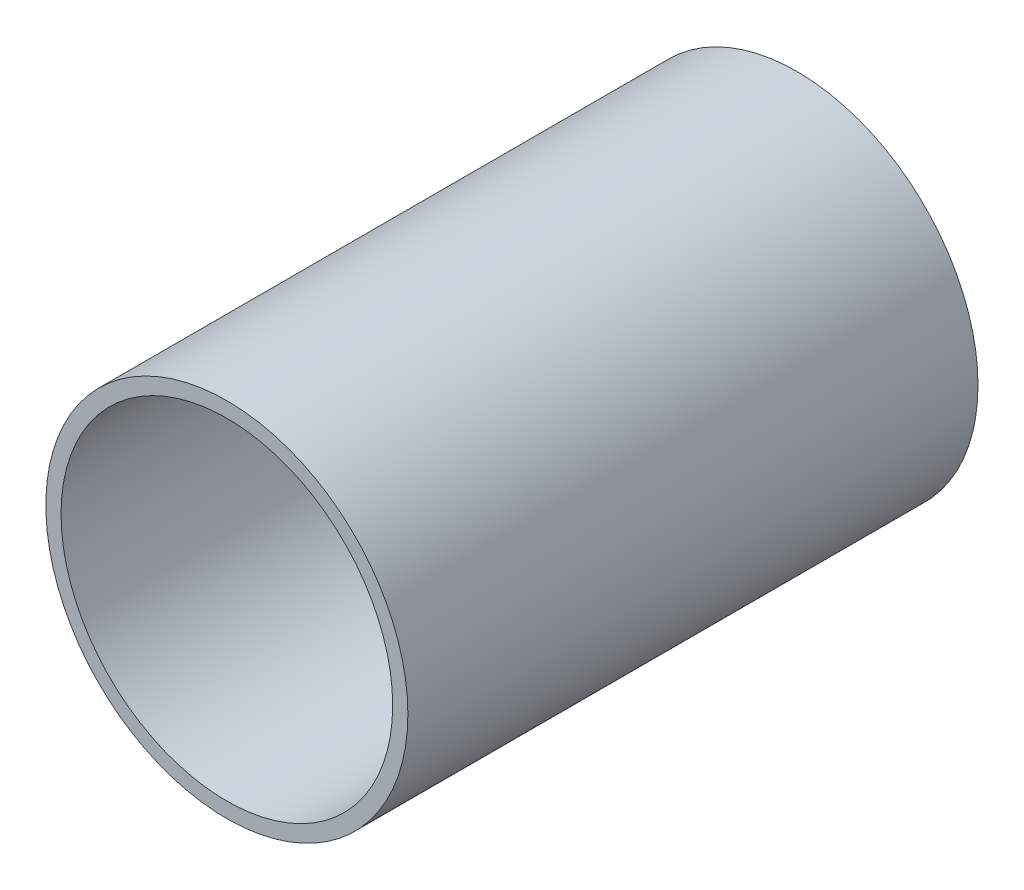
from build123d import *

# Parameters (mm, degrees)
SKETCH_1_R      = 19.05
SKETCH_1_R_2    = 17.45
EXTRUDE_1_DEPTH = 60


with BuildPart() as part:
    # 草圖1 → 填料-伸長1 (new body)
    with BuildSketch(Plane.XY):
        Circle(SKETCH_1_R)
        Circle(SKETCH_1_R_2, mode=Mode.SUBTRACT)
    extrude(amount=EXTRUDE_1_DEPTH)


solid = part.part
